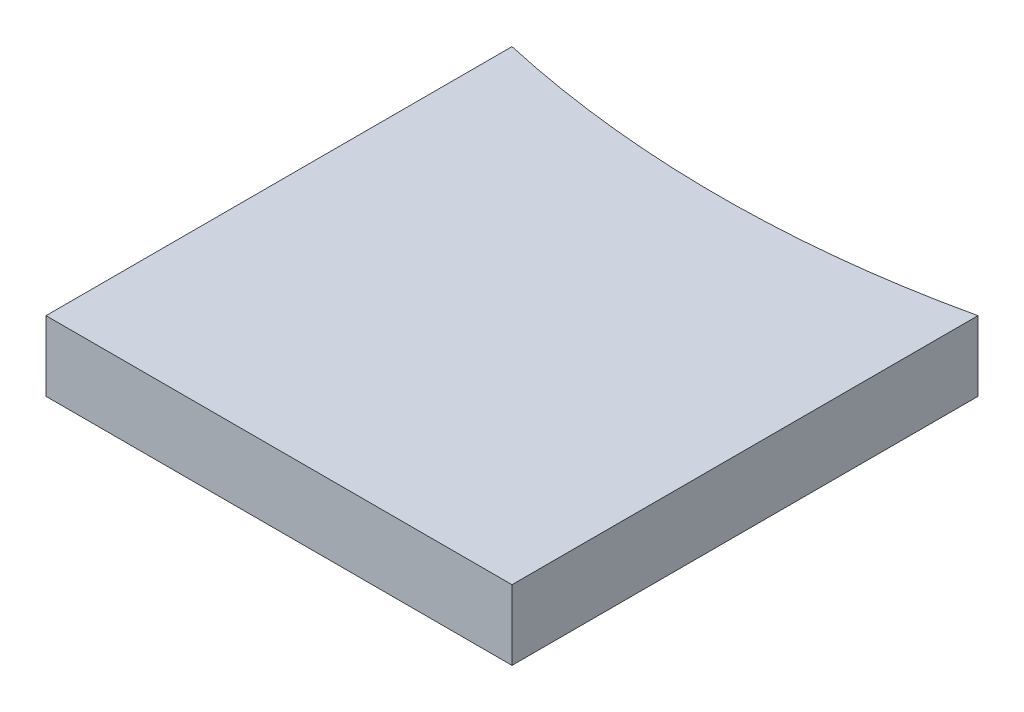
from build123d import *

# Parameters (mm, degrees)
BOSS_EXTRUDE1_DEPTH = 3


with BuildPart() as part:
    # Sketch1 → Boss-Extrude1 (new body)
    with BuildSketch(Plane(origin=(0, 0, 0), x_dir=(1, 0, 0), z_dir=(0, 1, 0))):
        with BuildLine():
            Line((0, 0), (20, 0))
            Line((20, 0), (20, 20))
            ThreePointArc((20, 20), (10, 18.888051988), (0, 20))
            Line((0, 20), (0, 0))
        make_face()
    extrude(amount=BOSS_EXTRUDE1_DEPTH)


solid = part.part
